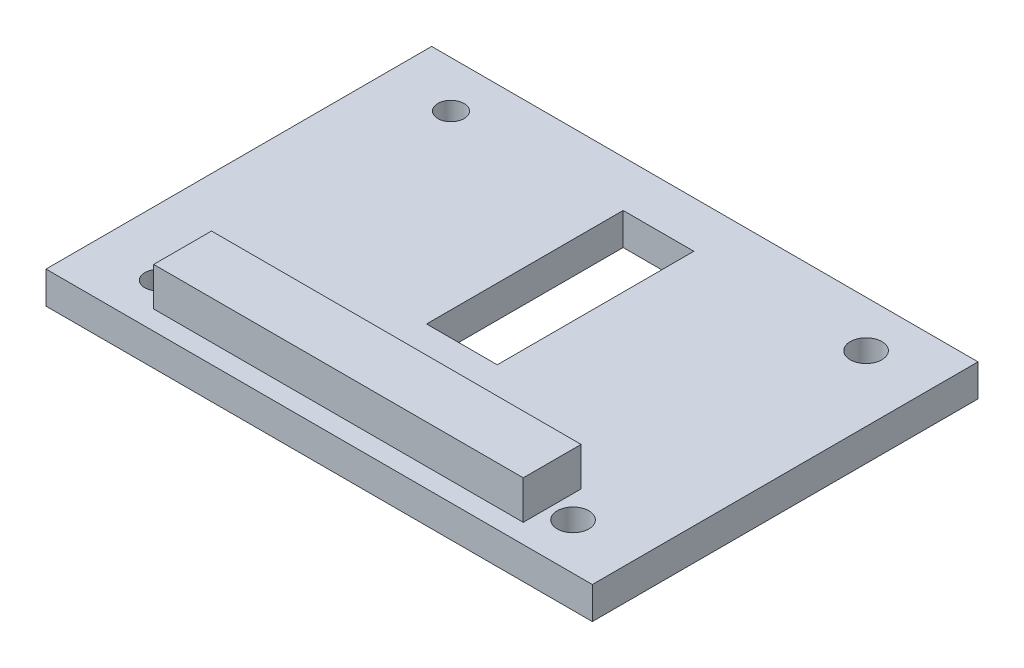
from build123d import *

# Parameters (mm, degrees)
F_01_BASE_PROFILE_W           = 170
F_01_BASE_PROFILE_H           = 120
F_01_BASE_PROFILE_R           = 4.084295612
F_01_BASE_PROFILE_R_2         = 4.915704388
F_01_BASE_PROFILE_W_2         = 22
F_01_BASE_PROFILE_H_2         = 61.1778291
F_01_BASE_EXTRUDE_DEPTH       = 10
F_02_BOSS_PROFILE_W           = 115
F_02_BOSS_PROFILE_H           = 18
F_02_REINFORCEMENT_BOSS_DEPTH = 22


with BuildPart() as part:
    # 01_Base_Profile → 01_Base_Extrude (new body)
    with BuildSketch(Plane(origin=(0, 0, 0), x_dir=(1, 0, 0), z_dir=(0, 1, 0))):
        Rectangle(F_01_BASE_PROFILE_W, F_01_BASE_PROFILE_H)
        with Locations(Location((-64.584295612, -45.58891455, 0), (0, 0, 270))):
            Circle(F_01_BASE_PROFILE_R, mode=Mode.SUBTRACT)
        with Locations(Location((64.584295612, -45.58891455, 0), (0, 0, 270))):
            Circle(F_01_BASE_PROFILE_R_2, mode=Mode.SUBTRACT)
        with Locations(Location((-64.584295612, 45.58891455, 0), (0, 0, 270))):
            Circle(F_01_BASE_PROFILE_R, mode=Mode.SUBTRACT)
        with Locations(Location((64.584295612, 45.58891455, 0), (0, 0, 270))):
            Circle(F_01_BASE_PROFILE_R_2, mode=Mode.SUBTRACT)
        with Locations((0, 15)):
            Rectangle(F_01_BASE_PROFILE_W_2, F_01_BASE_PROFILE_H_2, mode=Mode.SUBTRACT)
    extrude(amount=F_01_BASE_EXTRUDE_DEPTH)

    # 02_Boss_Profile → 02_Reinforcement_Boss (add)
    with BuildSketch(Plane(origin=(0, 0, 0), x_dir=(1, 0, 0), z_dir=(0, 1, 0))):
        with Locations((0, -45)):
            Rectangle(F_02_BOSS_PROFILE_W, F_02_BOSS_PROFILE_H)
    extrude(amount=F_02_REINFORCEMENT_BOSS_DEPTH)


solid = part.part
